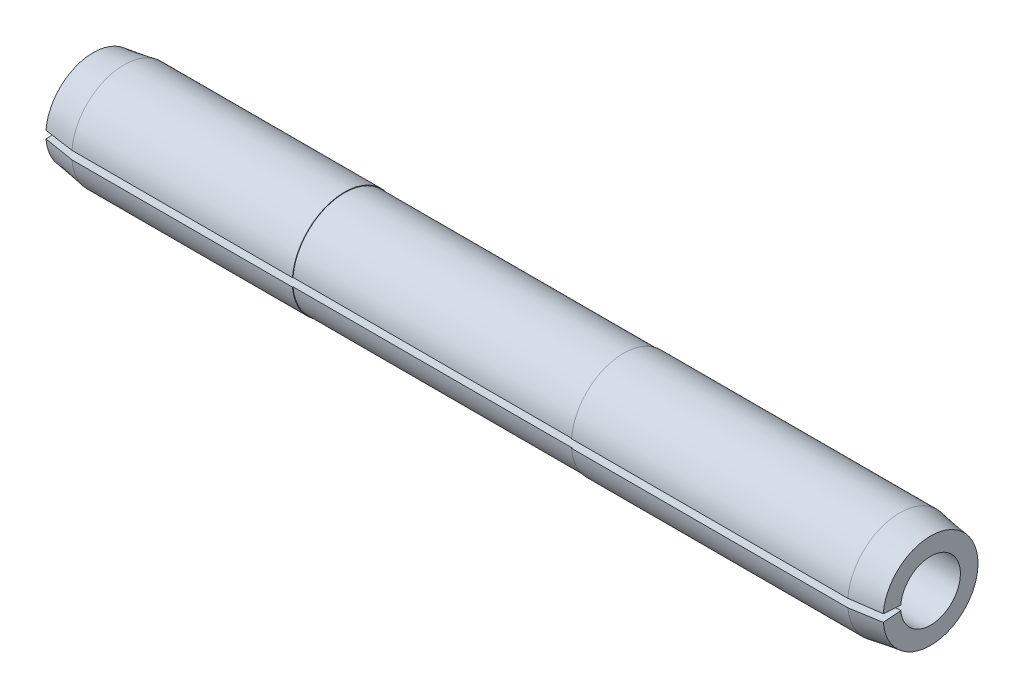
from build123d import *

# Parameters (mm, degrees)
GAP_DEPTH               = 39.247748954
CUT_EXTRUDE1_DEPTH      = 6.35
CUT_EXTRUDE1_DEPTH_BACK = 6.35
SKETCH3_R               = 4.928370377
SKETCH3_R_2             = 2.3495


with BuildPart() as part:
    # Sketch1 → Base-Revolve (revolve)
    with BuildSketch(Plane.XY, mode=Mode.PRIVATE) as base_revolve_sk:
        Polygon((0, 1.3589), (38.1, 1.3589), (38.1, 2.159), (36.703, 2.3749), (1.397, 2.3749), (0, 2.159), align=None)
    revolve(base_revolve_sk.sketch.rotate(Axis((-9.525, 0, 0), (1, 0, 0)), 90), axis=Axis((-9.525, 0, 0), (1, 0, 0)))

    # Sketch2 → Gap (cut, through all)
    with BuildSketch(Plane(origin=(0, 0, 0), x_dir=(0, -1, 0), z_dir=(-1, 0, 0))):
        with BuildLine():
            Line((0, 0), (0.190059157, 2.414930555))
            ThreePointArc((0.190059157, 2.414930555), (0, 2.422398), (-0.190059157, 2.414930555))
            Line((-0.190059157, 2.414930555), (0, 0))
        make_face()
    extrude(amount=-GAP_DEPTH, mode=Mode.SUBTRACT)

    # Sketch3 → Cut-Extrude1 (cut, two sides: drawn at the far end of the back side and taken through both)
    with BuildSketch(Plane(origin=(17.78, 0, 0), x_dir=(0, 0, -1), z_dir=(1, 0, 0)).offset(-CUT_EXTRUDE1_DEPTH_BACK)):
        Circle(SKETCH3_R)
        Circle(SKETCH3_R_2, mode=Mode.SUBTRACT)
    extrude(amount=CUT_EXTRUDE1_DEPTH + CUT_EXTRUDE1_DEPTH_BACK, mode=Mode.SUBTRACT)


solid = part.part
